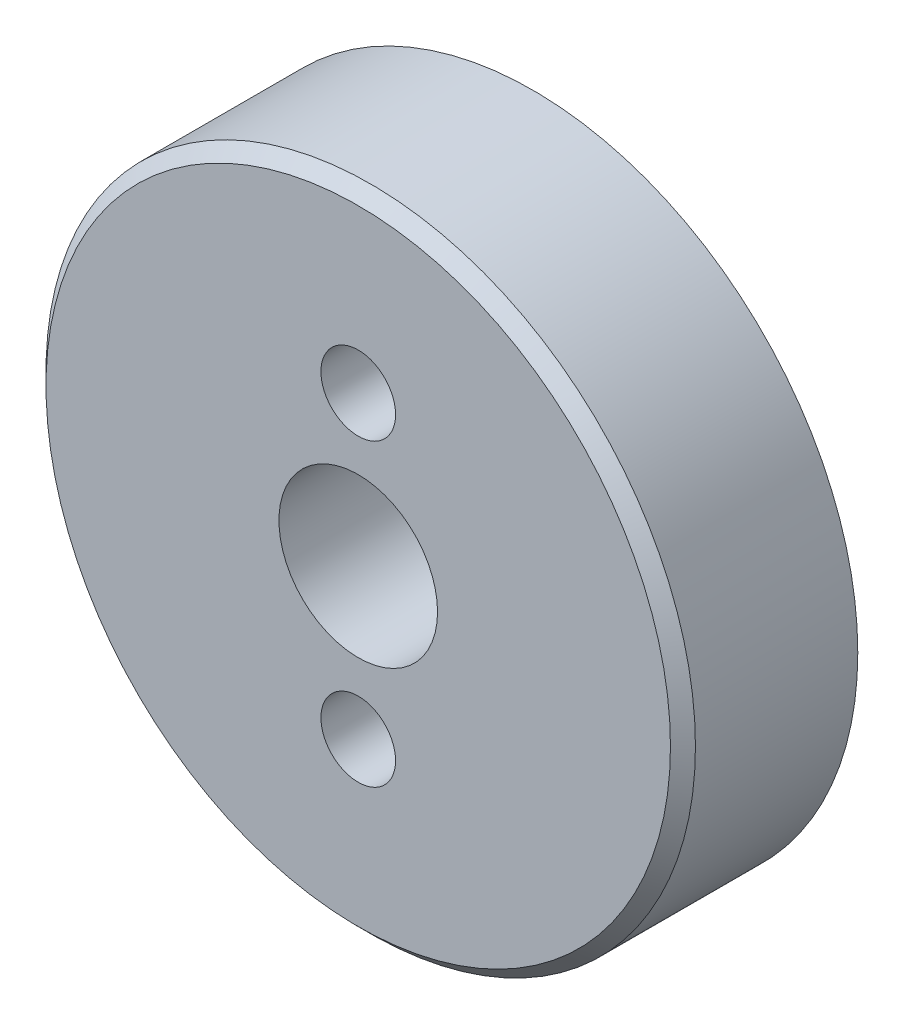
from build123d import *

# Parameters (mm, degrees)
SKETCH_1_R      = 13
SKETCH_1_R_2    = 3.175
SKETCH_1_R_3    = 1.494405319
EXTRUDE_1_DEPTH = 7
CHAMFER_1_SIZE  = 0.5


with BuildPart() as part:
    # Эскиз1 → Вытянуть1 (new body)
    with BuildSketch(Plane.XY):
        Circle(SKETCH_1_R)
        Circle(SKETCH_1_R_2, mode=Mode.SUBTRACT)
        with Locations((0, 6)):
            Circle(SKETCH_1_R_3, mode=Mode.SUBTRACT)
        with Locations((0, -6)):
            Circle(SKETCH_1_R_3, mode=Mode.SUBTRACT)
    extrude(amount=EXTRUDE_1_DEPTH)

    # Фаска1
    chamfer_1_edges = [part.edges().sort_by_distance(p)[0] for p in [
        (-13, 0, 7),
    ]]
    chamfer(chamfer_1_edges, length=CHAMFER_1_SIZE)


solid = part.part
